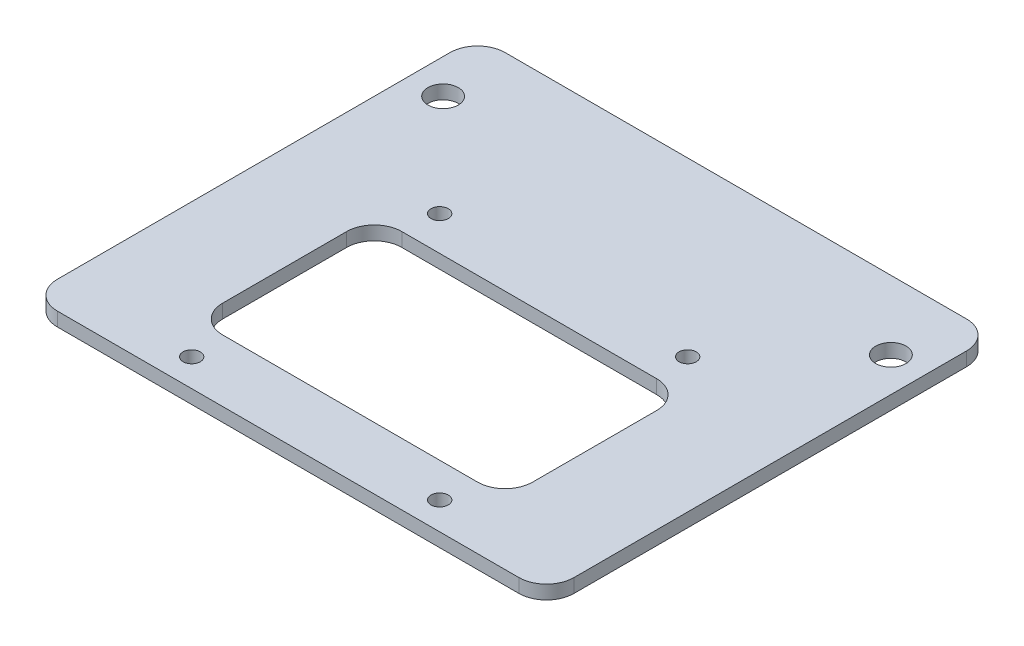
from build123d import *

# Parameters (mm, degrees)
SKETCH_1_W              = 75
SKETCH_1_H              = 65
EXTRUDE_1_DEPTH         = 2
HOLE_WIZARD_4_4_4_4_1_D = 4.4
HOLE_WIZARD_2_5_2_5_1_D = 2.5
FILLET_1_R              = 4
SKETCH_6_W              = 45
SKETCH_6_H              = 26
CUT_EXTRUDE_1_DEPTH     = 50.663870167
FILLET_2_R              = 4


with BuildPart() as part:
    # 草图1 → 凸台-拉伸1 (new body)
    with BuildSketch(Plane(origin=(0, 0, 0), x_dir=(1, 0, 0), z_dir=(0, 1, 0))):
        Rectangle(SKETCH_1_W, SKETCH_1_H)
    extrude(amount=EXTRUDE_1_DEPTH)

    # Ø4.4 (4.4) 直径孔1 (through all)
    with Locations(Plane(origin=(-32.5, 2, -22.5), x_dir=(0, 0, 1), z_dir=(0, 1, 0))):
        with Locations((0, 0), (0, 65)):
            Hole(HOLE_WIZARD_4_4_4_4_1_D / 2)

    # Ø2.5 (2.5) 直径孔1 (through all)
    with Locations(Plane(origin=(-18, 2, -7.5), x_dir=(0, 0, 1), z_dir=(0, 1, 0))):
        with Locations((0, 0), (36, 0)):
            hole_wizard_2_5_2_5_1 = Hole(HOLE_WIZARD_2_5_2_5_1_D / 2)

    # 镜向1: Ø2.5 (2.5) 直径孔1 across plane
    add(hole_wizard_2_5_2_5_1.mirror(Plane(origin=(0, 0, 0), x_dir=(0, 0, 1), z_dir=(1, 0, 0))), mode=Mode.SUBTRACT)

    # 圆角1
    fillet_1_edges = [part.edges().sort_by_distance(p)[0] for p in [
        (37.5, 1, 32.5),
        (-37.5, 1, 32.5),
        (-37.5, 1, -32.5),
        (37.5, 1, -32.5),
    ]]
    fillet(fillet_1_edges, radius=FILLET_1_R)

    # 草图6 → 切除-拉伸1 (cut, through all)
    with BuildSketch(Plane(origin=(0, 2, 0), x_dir=(1, 0, 0), z_dir=(0, 1, 0))):
        with Locations((0, -10.5)):
            Rectangle(SKETCH_6_W, SKETCH_6_H)
    extrude(amount=-CUT_EXTRUDE_1_DEPTH, mode=Mode.SUBTRACT)

    # 圆角2
    fillet_2_edges = [part.edges().sort_by_distance(p)[0] for p in [
        (-22.5, 1, 23.5),
        (-22.5, 1, -2.5),
        (22.5, 1, -2.5),
        (22.5, 1, 23.5),
    ]]
    fillet(fillet_2_edges, radius=FILLET_2_R)


solid = part.part
